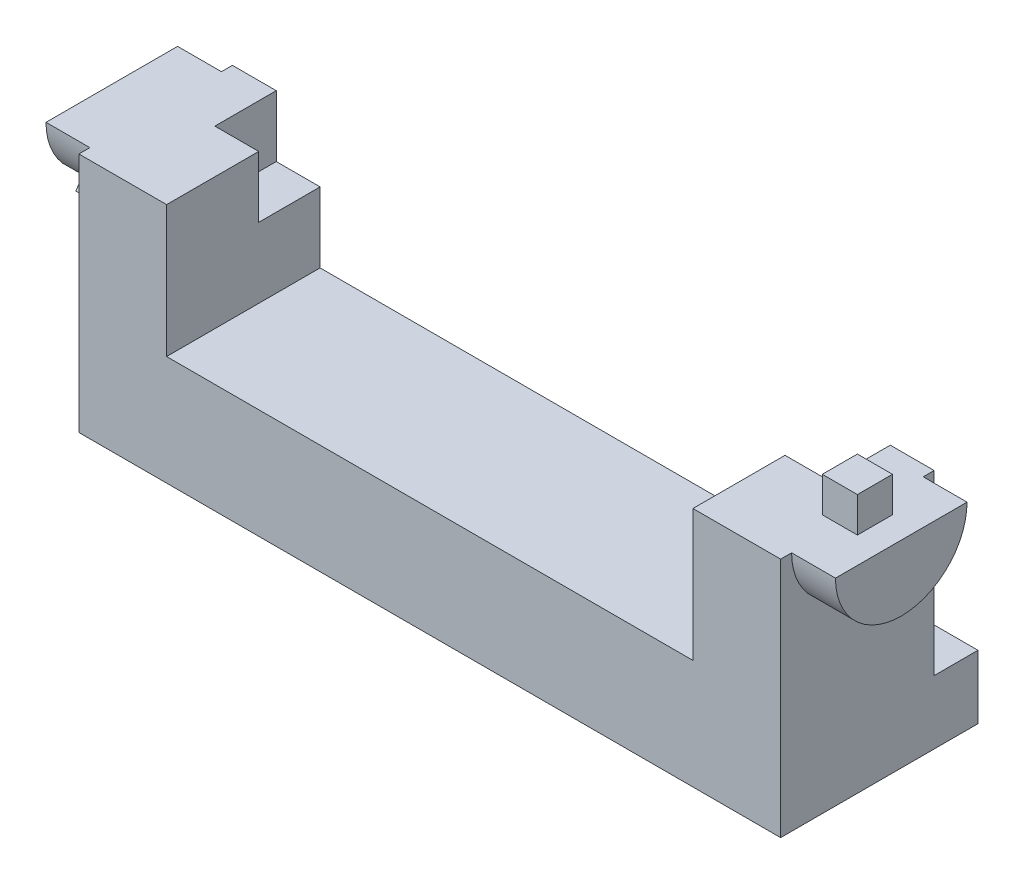
from build123d import *

# Parameters (mm, degrees)
SKETCH1_W           = 40.64
SKETCH1_H           = 6.35
BOSS_EXTRUDE1_DEPTH = 8.89
SKETCH2_W           = 5.08
SKETCH2_H           = 8.89
BOSS_EXTRUDE2_DEPTH = 7.62
SKETCH3_W           = 5.08
SKETCH3_H           = 8.89
BOSS_EXTRUDE3_DEPTH = 7.62
SKETCH4_W           = 3.556
SKETCH4_H           = 3.556
CUT_EXTRUDE1_DEPTH  = 2.54
BOSS_EXTRUDE4_DEPTH = 2.54
SKETCH6_W           = 40.64
SKETCH6_H           = 3.683
BOSS_EXTRUDE5_DEPTH = 2.54
SKETCH7_W           = 3.556
SKETCH7_H           = 4.572
CUT_EXTRUDE2_DEPTH  = 2.54
BOSS_EXTRUDE6_START = 2.54
BOSS_EXTRUDE6_DEPTH = 2.54
WRAP2_SECTION_W     = 0.762
WRAP2_SECTION_H     = 1.016
WRAP2_ANGLE         = 76.394372684
SKETCH11_W          = 0.508
SKETCH11_H          = 6.35
CUT_EXTRUDE3_DEPTH  = 1.27
SKETCH12_W          = 2.032
SKETCH12_H          = 2.032
BOSS_EXTRUDE7_DEPTH = 2.032


with BuildPart() as part:
    # Sketch1 → Boss-Extrude1 (new body)
    with BuildSketch(Plane.XY):
        with Locations((20.32, 3.175)):
            Rectangle(SKETCH1_W, SKETCH1_H)
    extrude(amount=BOSS_EXTRUDE1_DEPTH)

    # Sketch2 → Boss-Extrude2 (add)
    with BuildSketch(Plane(origin=(0, 6.35, 0), x_dir=(1, 0, 0), z_dir=(0, 1, 0))):
        with Locations((2.54, -4.445)):
            Rectangle(SKETCH2_W, SKETCH2_H)
    extrude(amount=BOSS_EXTRUDE2_DEPTH)

    # Sketch3 → Boss-Extrude3 (add)
    with BuildSketch(Plane(origin=(0, 6.35, 0), x_dir=(1, 0, 0), z_dir=(0, 1, 0))):
        with Locations((38.1, -4.445)):
            Rectangle(SKETCH3_W, SKETCH3_H)
    extrude(amount=BOSS_EXTRUDE3_DEPTH)

    # Sketch4 → Cut-Extrude1 (cut)
    with BuildSketch(Plane(origin=(5.08, 0, 0), x_dir=(0, 0, -1), z_dir=(1, 0, 0))):
        with Locations((-1.778, 12.192)):
            Rectangle(SKETCH4_W, SKETCH4_H)
    extrude(amount=-CUT_EXTRUDE1_DEPTH, mode=Mode.SUBTRACT)

    # Sketch5 → Boss-Extrude4 (add)
    with BuildSketch(Plane.ZY):
        with BuildLine():
            Line((8.255, 13.97), (0.635, 13.97))
            ThreePointArc((0.635, 13.97), (4.445, 10.16), (8.255, 13.97))
        make_face()
    extrude(amount=BOSS_EXTRUDE4_DEPTH)

    # Sketch6 → Boss-Extrude5 (add)
    with BuildSketch(Plane(origin=(0, 0, 0), x_dir=(-1, 0, 0), z_dir=(0, 0, -1))):
        with Locations((-20.32, 1.8415)):
            Rectangle(SKETCH6_W, SKETCH6_H)
    extrude(amount=BOSS_EXTRUDE5_DEPTH)

    # Sketch7 → Cut-Extrude2 (cut)
    with BuildSketch(Plane.ZY.offset(-35.56)):
        with Locations((1.778, 11.684)):
            Rectangle(SKETCH7_W, SKETCH7_H)
    extrude(amount=-CUT_EXTRUDE2_DEPTH, mode=Mode.SUBTRACT)

    # Sketch8 → Boss-Extrude6 (add)
    with BuildSketch(Plane(origin=(40.64, 0, 0), x_dir=(0, 0, -1), z_dir=(1, 0, 0)).offset(BOSS_EXTRUDE6_START)):
        with BuildLine():
            Line((-0.635, 13.97), (-8.255, 13.97))
            ThreePointArc((-8.255, 13.97), (-4.445, 10.16), (-0.635, 13.97))
        make_face()
    extrude(amount=-BOSS_EXTRUDE6_DEPTH)

    # Wrap2 section (on wrap section) → Wrap2 (revolve)
    with BuildSketch(Plane(origin=(0, 13.97, 4.445), x_dir=(0, -0.8032608103480625, 0.5956274595407551), z_dir=(0, 0.5956274595407551, 0.8032608103480625))):
        with Locations((4.191, -1.397)):
            Rectangle(WRAP2_SECTION_W, WRAP2_SECTION_H)
    revolve(axis=Axis((0, 13.97, 4.445), (1, 0, 0)), revolution_arc=WRAP2_ANGLE)

    # Sketch11 → Cut-Extrude3 (cut)
    with BuildSketch(Plane.XZ):
        with Locations((20.32, 0.635)):
            Rectangle(SKETCH11_W, SKETCH11_H)
    extrude(amount=-CUT_EXTRUDE3_DEPTH, mode=Mode.SUBTRACT)

    # Sketch12 → Boss-Extrude7 (add)
    with BuildSketch(Plane(origin=(0, 13.97, 0), x_dir=(1, 0, 0), z_dir=(0, 1, 0))):
        with Locations((40.64, -4.445)):
            Rectangle(SKETCH12_W, SKETCH12_H)
    extrude(amount=BOSS_EXTRUDE7_DEPTH)


solid = part.part
